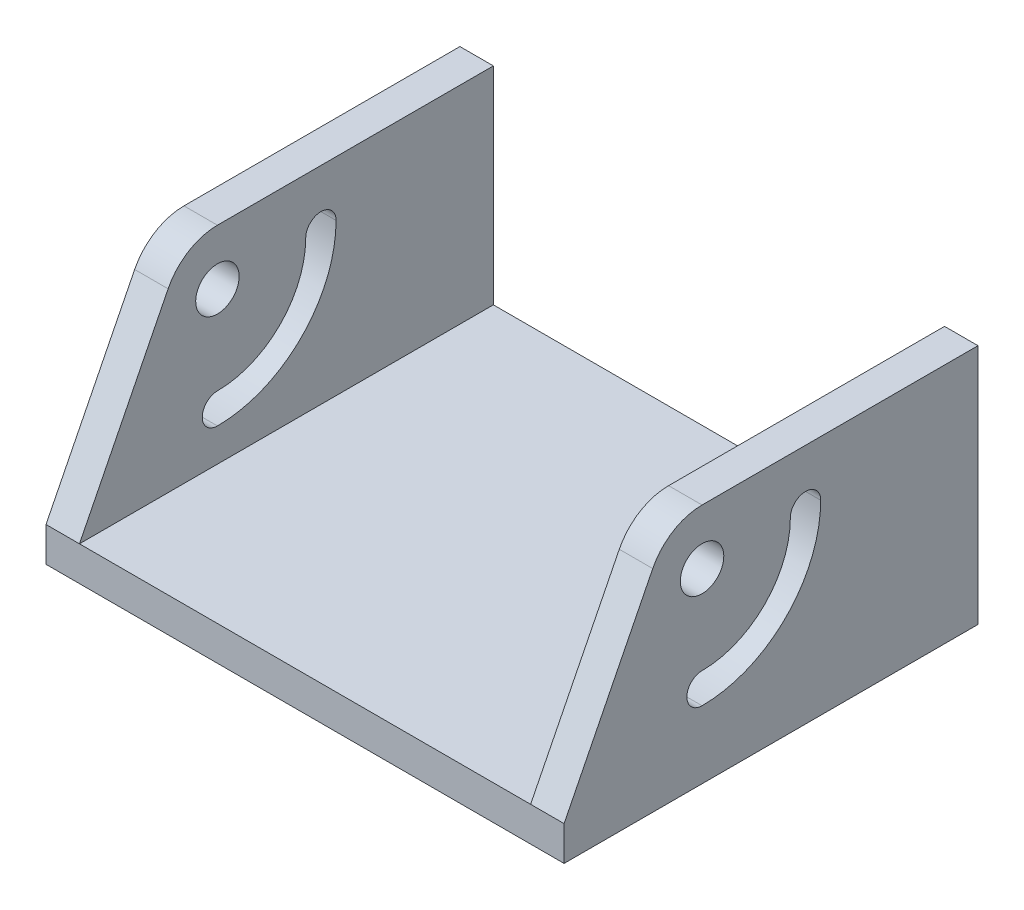
from build123d import *

# Parameters (mm, degrees)
EXTRUDE_1_DEPTH      = 30
EXTRUDE_1_DEPTH_BACK = 30
SKETCH_3_R           = 3.15
CUT_EXTRUDE_1_DEPTH  = 89.119294142


with BuildPart() as part:
    # 草图1 → 凸台-拉伸1 (new, two sides: drawn at the far end of the back side and taken through both)
    with BuildSketch(Plane.XY.offset(-EXTRUDE_1_DEPTH_BACK)):
        Polygon((-37.55, 0), (37.55, 0), (37.55, 35), (32.7, 35), (32.7, 5), (-32.7, 5), (-32.7, 35), (-37.55, 35), align=None)
    extrude(amount=EXTRUDE_1_DEPTH + EXTRUDE_1_DEPTH_BACK)

    # 草图3 → 切除-拉伸1 (cut, through all)
    with BuildSketch(Plane.ZY.offset(37.55)):
        with BuildLine():
            ThreePointArc((10, 9.8), (12.2, 12), (10, 14.2))
            ThreePointArc((10, 14.2), (0.949033201, 17.949033201), (-2.8, 27))
            ThreePointArc((-2.8, 27), (-5, 29.2), (-7.2, 27))
            ThreePointArc((-7.2, 27), (-2.162236636, 14.837763364), (10, 9.8))
        make_face()
        with Locations((10, 27)):
            Circle(SKETCH_3_R)
        with BuildLine():
            Line((17.149177618, 30.590161471), (30, 5))
            Line((30, 5), (30, 35))
            Line((30, 35), (10, 35))
            ThreePointArc((10, 35), (14.199923108, 33.808865242), (17.149177618, 30.590161471))
        make_face()
    extrude(amount=-CUT_EXTRUDE_1_DEPTH, mode=Mode.SUBTRACT)


solid = part.part
